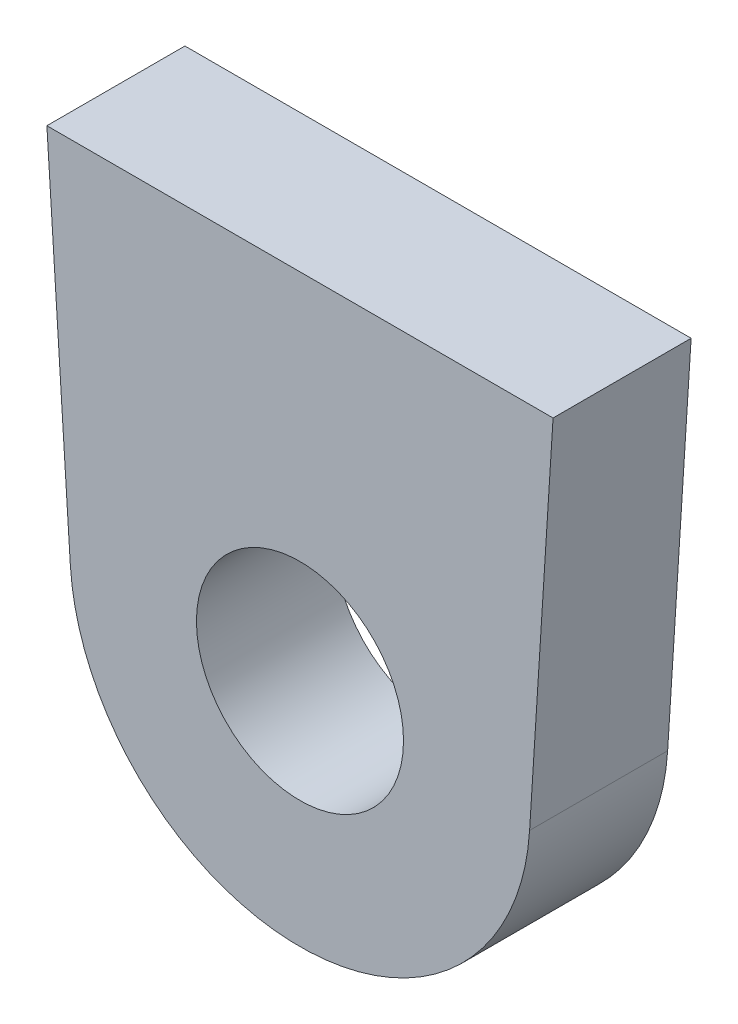
from build123d import *

# Parameters (mm, degrees)
SKETCH_1_R      = 22.5
EXTRUDE_1_DEPTH = 30


with BuildPart() as part:
    # 草图1 → 凸台-拉伸1 (new body)
    with BuildSketch(Plane.XY):
        with BuildLine():
            Line((-55, 77), (55, 77))
            Line((55, 77), (49.899111641, -3.174690133))
            ThreePointArc((49.899111641, -3.174690133), (0, -50), (-49.899111641, -3.174690133))
            Line((-49.899111641, -3.174690133), (-55, 77))
        make_face()
        Circle(SKETCH_1_R, mode=Mode.SUBTRACT)
    extrude(amount=EXTRUDE_1_DEPTH)


solid = part.part
